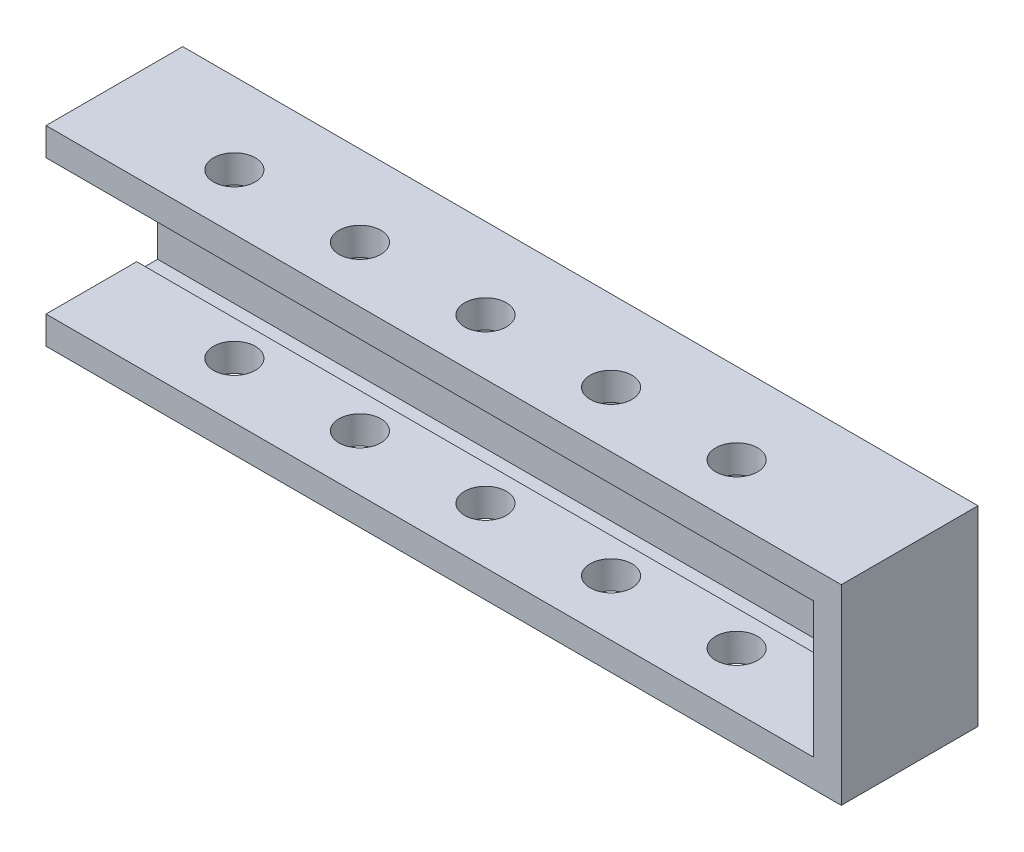
from build123d import *

# Parameters (mm, degrees)
SKETCH_1_W          = 57
SKETCH_1_H          = 13.7
EXTRUDE_1_DEPTH     = 9.8
SKETCH_2_W          = 55
SKETCH_2_H          = 9.7
CUT_EXTRUDE_1_DEPTH = 8
SKETCH_3_W          = 54.972087022
SKETCH_3_H          = 0.6
CUT_EXTRUDE_2_DEPTH = 1.5
SKETCH_4_R          = 1.5
CUT_EXTRUDE_3_DEPTH = 14


with BuildPart() as part:
    # Эскиз1 → Бобышка-Вытянуть1 (new body)
    with BuildSketch(Plane.XY):
        with Locations((28.5, 6.85)):
            Rectangle(SKETCH_1_W, SKETCH_1_H)
    extrude(amount=EXTRUDE_1_DEPTH)

    # Эскиз2 → Вырез-Вытянуть1 (cut)
    with BuildSketch(Plane.XY.offset(9.8)):
        with Locations((27.5, 6.85)):
            Rectangle(SKETCH_2_W, SKETCH_2_H)
    extrude(amount=-CUT_EXTRUDE_1_DEPTH, mode=Mode.SUBTRACT)

    # Эскиз3 → Вырез-Вытянуть2 (cut)
    with BuildSketch(Plane.XY.offset(1.8)):
        with Locations((27.486043511, 12)):
            Rectangle(SKETCH_3_W, SKETCH_3_H)
        with Locations((27.486043511, 1.7)):
            Rectangle(SKETCH_3_W, SKETCH_3_H)
    extrude(amount=CUT_EXTRUDE_2_DEPTH, mode=Mode.SUBTRACT)

    # Эскиз4 → Вырез-Вытянуть3 (cut)
    with BuildSketch(Plane(origin=(0, 13.7, 0), x_dir=(1, 0, 0), z_dir=(0, 1, 0))):
        with Locations(Location((45.5, -5.8, 0), (0, 0, 270))):
            Circle(SKETCH_4_R)
        with Locations(Location((36.5, -5.8, 0), (0, 0, 270))):
            Circle(SKETCH_4_R)
        with Locations(Location((27.5, -5.8, 0), (0, 0, 270))):
            Circle(SKETCH_4_R)
        with Locations(Location((18.5, -5.8, 0), (0, 0, 270))):
            Circle(SKETCH_4_R)
        with Locations(Location((9.5, -5.8, 0), (0, 0, 270))):
            Circle(SKETCH_4_R)
    extrude(amount=-CUT_EXTRUDE_3_DEPTH, mode=Mode.SUBTRACT)


solid = part.part
